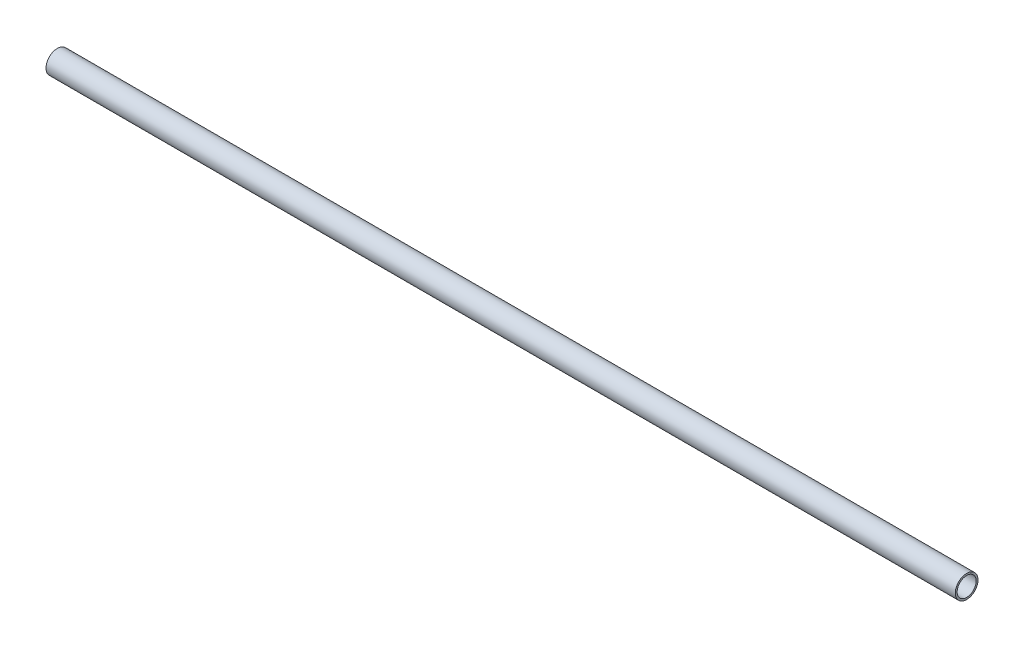
from build123d import *

# Parameters (mm, degrees)
SKETCH1_R           = 24.13
SKETCH1_R_2         = 20.193
BOSS_EXTRUDE1_DEPTH = 1930.4


with BuildPart() as part:
    # Sketch1 → Boss-Extrude1 (new body)
    with BuildSketch(Plane(origin=(0, 0, 0), x_dir=(0, 0, -1), z_dir=(1, 0, 0))):
        with Locations(Location((0, 0, 0), (0, 0, 180))):
            Circle(SKETCH1_R)
        with Locations(Location((0, 0, 0), (0, 0, 180))):
            Circle(SKETCH1_R_2, mode=Mode.SUBTRACT)
    extrude(amount=BOSS_EXTRUDE1_DEPTH)


solid = part.part
